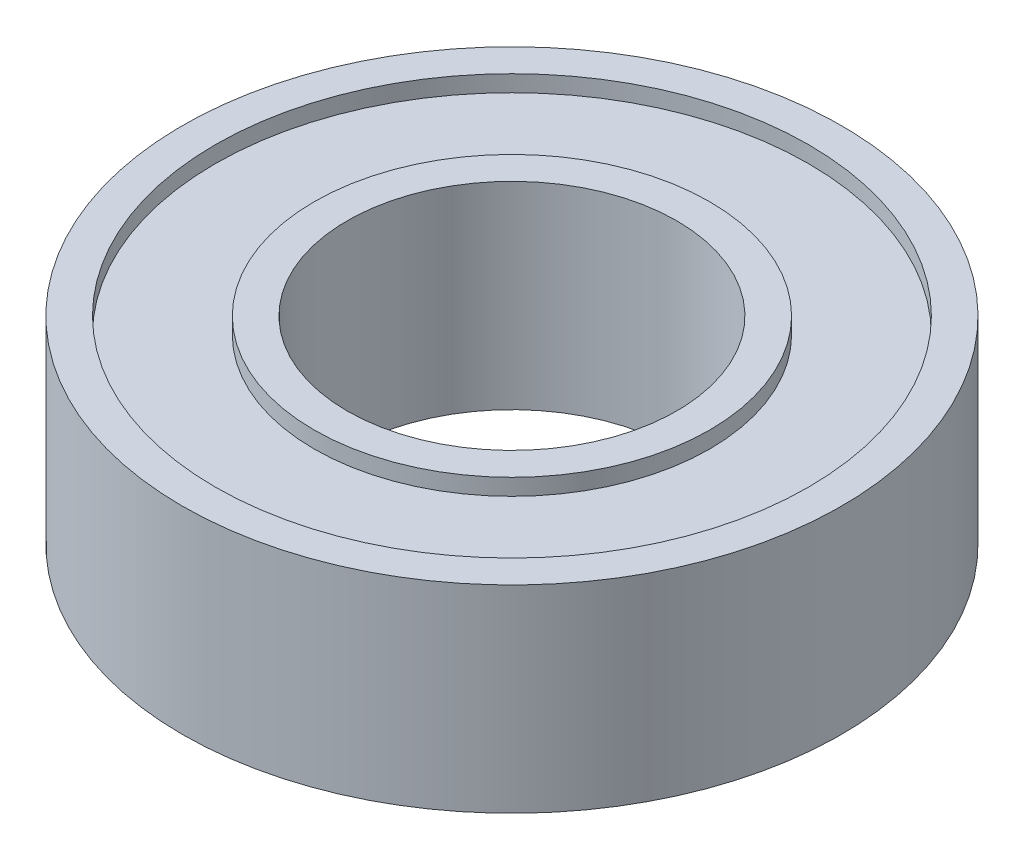
from build123d import *

# Parameters (mm, degrees)
SKETCH1_R           = 5
SKETCH1_R_2         = 2.5
BOSS_EXTRUDE1_DEPTH = 3
SKETCH2_R           = 4.5
SKETCH2_R_2         = 3
CUT_EXTRUDE1_DEPTH  = 0.25
CUT_EXTRUDE2_START  = -0.25
SKETCH3_R           = 4.5
SKETCH3_R_2         = 3
CUT_EXTRUDE2_DEPTH  = 0.25


with BuildPart() as part:
    # Sketch1 → Boss-Extrude1 (new body)
    with BuildSketch(Plane(origin=(0, 0, 0), x_dir=(1, 0, 0), z_dir=(0, 1, 0))):
        with Locations(Location((0, 0, 0), (0, 0, 270))):
            Circle(SKETCH1_R)
        with Locations(Location((0, 0, 0), (0, 0, 270))):
            Circle(SKETCH1_R_2, mode=Mode.SUBTRACT)
    extrude(amount=BOSS_EXTRUDE1_DEPTH)

    # Sketch2 → Cut-Extrude1 (cut)
    with BuildSketch(Plane.XZ):
        with Locations(Location((0, 0, 0), (0, 0, 270))):
            Circle(SKETCH2_R)
        with Locations(Location((0, 0, 0), (0, 0, 270))):
            Circle(SKETCH2_R_2, mode=Mode.SUBTRACT)
    extrude(amount=-CUT_EXTRUDE1_DEPTH, mode=Mode.SUBTRACT)

    # Sketch3 → Cut-Extrude2 (cut)
    with BuildSketch(Plane(origin=(0, 3, 0), x_dir=(1, 0, 0), z_dir=(0, 1, 0)).offset(CUT_EXTRUDE2_START)):
        with Locations(Location((0, 0, 0), (0, 0, 90))):
            Circle(SKETCH3_R)
        with Locations(Location((0, 0, 0), (0, 0, 90))):
            Circle(SKETCH3_R_2, mode=Mode.SUBTRACT)
    extrude(amount=CUT_EXTRUDE2_DEPTH, mode=Mode.SUBTRACT)


solid = part.part
